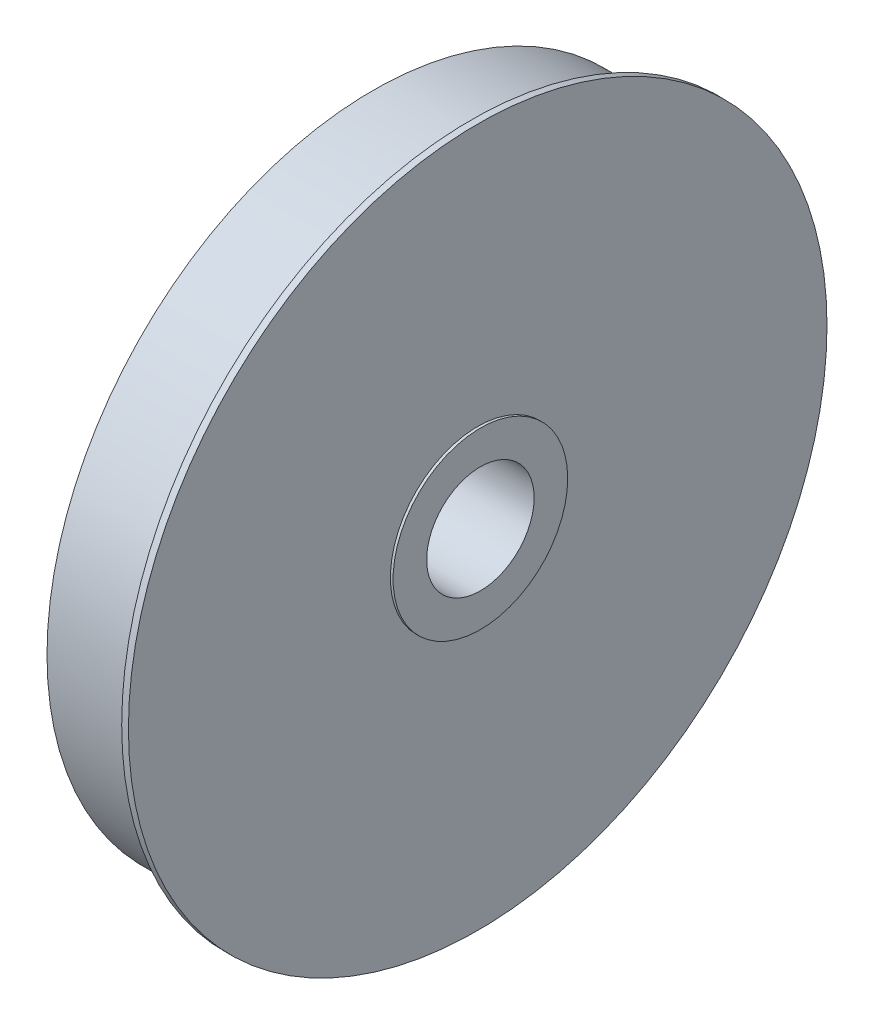
from build123d import *
from build123d.topology import SkipClean

# Parameters (mm, degrees)
PER_AGE1_D         = 8
ESQUISSE13_R       = 6.5
ESQUISSE13_R_2     = 4
BOSS_EXTRU_1_DEPTH = 0.2


with BuildPart() as part:
    # Esquisse1 → Base-Révolution (revolve)
    with BuildSketch(Plane.XY, mode=Mode.PRIVATE) as base_r_volution_sk:
        Polygon((0, 0), (8.8, 0), (8.8, 26), (8.3, 26), (7.8, 25.133974596), (7.8, 24.26), (1, 24.26), (1, 20), (0, 20), align=None)
    revolve(base_r_volution_sk.sketch.rotate(Axis((-7.956160198, 0, 0), (1, 0, 0)), 90), axis=Axis((-7.956160198, 0, 0), (1, 0, 0)))

    # Perçage1 (through all)
    with Locations(Plane(origin=(8.8, 0, 0), x_dir=(0, 0, -1), z_dir=(1, 0, 0))):
        with Locations((0, 0)):
            Hole(PER_AGE1_D / 2)

    # Esquisse13 → Boss.-Extru.1 (add)
    with SkipClean():  # the faces are left unmerged after this step: merging them gives an invalid solid
        with BuildSketch(Plane(origin=(8.8, 0, 0), x_dir=(0, 0, -1), z_dir=(1, 0, 0))):
            Circle(ESQUISSE13_R)
            Circle(ESQUISSE13_R_2, mode=Mode.SUBTRACT)
        extrude(amount=BOSS_EXTRU_1_DEPTH)


solid = part.part
